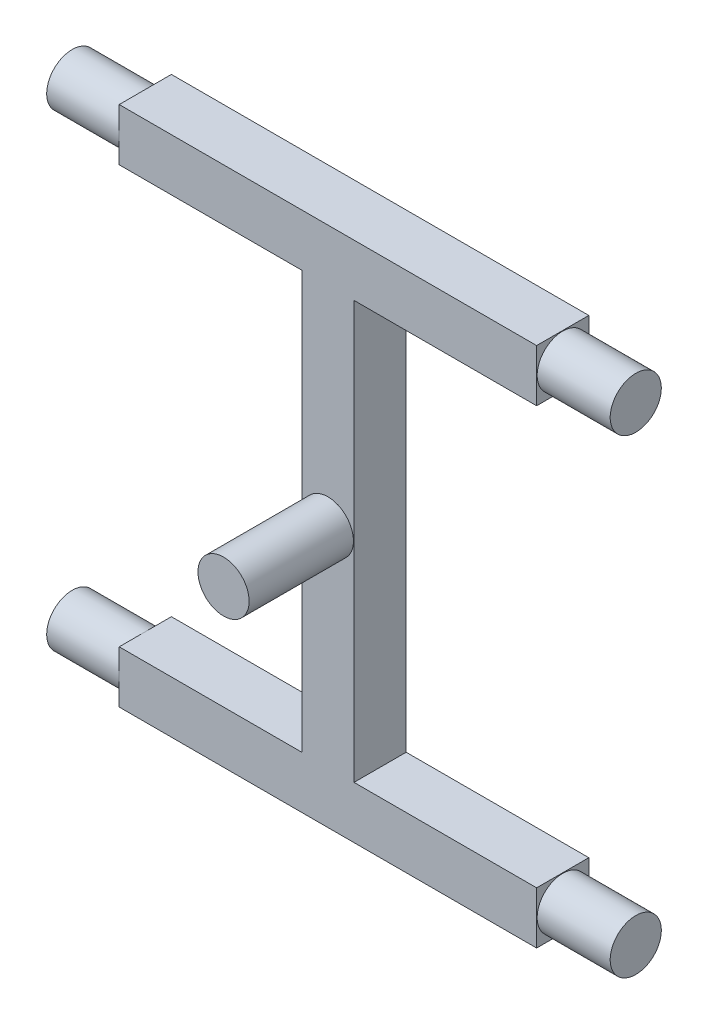
from build123d import *

# Parameters (mm, degrees)
CROQUIS2_W               = 400
CROQUIS2_H               = 500
SALIENTE_EXTRUIR3_DEPTH  = 50
CROQUIS7_W               = 175
CROQUIS7_H               = 400
CORTAR_EXTRUIR2_DEPTH    = 50
CROQUIS9_R               = 24.5
SALIENTE_EXTRUIR5_DEPTH  = 70
CROQUIS10_R              = 24.5
SALIENTE_EXTRUIR6_DEPTH  = 70
CROQUIS19_R              = 24.5
SALIENTE_EXTRUIR10_DEPTH = 70
CROQUIS20_R              = 24.5
SALIENTE_EXTRUIR11_DEPTH = 70
CROQUIS12_R              = 24.5
SALIENTE_EXTRUIR12_DEPTH = 100


with BuildPart() as part:
    # Croquis2 → Saliente-Extruir3 (new body)
    with BuildSketch(Plane.XY):
        Rectangle(CROQUIS2_W, CROQUIS2_H)
    extrude(amount=-SALIENTE_EXTRUIR3_DEPTH)

    # Croquis7 → Cortar-Extruir2 (cut)
    with BuildSketch(Plane.XY):
        with Locations((-112.5, 0)):
            Rectangle(CROQUIS7_W, CROQUIS7_H)
        with Locations((112.5, 0)):
            Rectangle(CROQUIS7_W, CROQUIS7_H)
    extrude(amount=-CORTAR_EXTRUIR2_DEPTH, mode=Mode.SUBTRACT)

    # Croquis9 → Saliente-Extruir5 (add)
    with BuildSketch(Plane.ZY.offset(200)):
        with Locations((-25, -225.045105614)):
            Circle(CROQUIS9_R)
    extrude(amount=SALIENTE_EXTRUIR5_DEPTH)

    # Croquis10 → Saliente-Extruir6 (add)
    with BuildSketch(Plane.ZY.offset(200)):
        with Locations(Location((-25, 223.724834231, 0), (0, 0, 255.54880869))):
            Circle(CROQUIS10_R)
    extrude(amount=SALIENTE_EXTRUIR6_DEPTH)

    # Croquis19 → Saliente-Extruir10 (add)
    with BuildSketch(Plane(origin=(200, 0, 0), x_dir=(0, 0, -1), z_dir=(1, 0, 0))):
        with Locations((25, -225)):
            Circle(CROQUIS19_R)
    extrude(amount=SALIENTE_EXTRUIR10_DEPTH)

    # Croquis20 → Saliente-Extruir11 (add)
    with BuildSketch(Plane(origin=(200, 0, 0), x_dir=(0, 0, -1), z_dir=(1, 0, 0))):
        with Locations((25, 225)):
            Circle(CROQUIS20_R)
    extrude(amount=SALIENTE_EXTRUIR11_DEPTH)

    # Croquis12 → Saliente-Extruir12 (add)
    with BuildSketch(Plane.XY):
        with Locations(Location((0, 0, 0), (0, 0, 180))):
            Circle(CROQUIS12_R)
    extrude(amount=SALIENTE_EXTRUIR12_DEPTH)


solid = part.part
